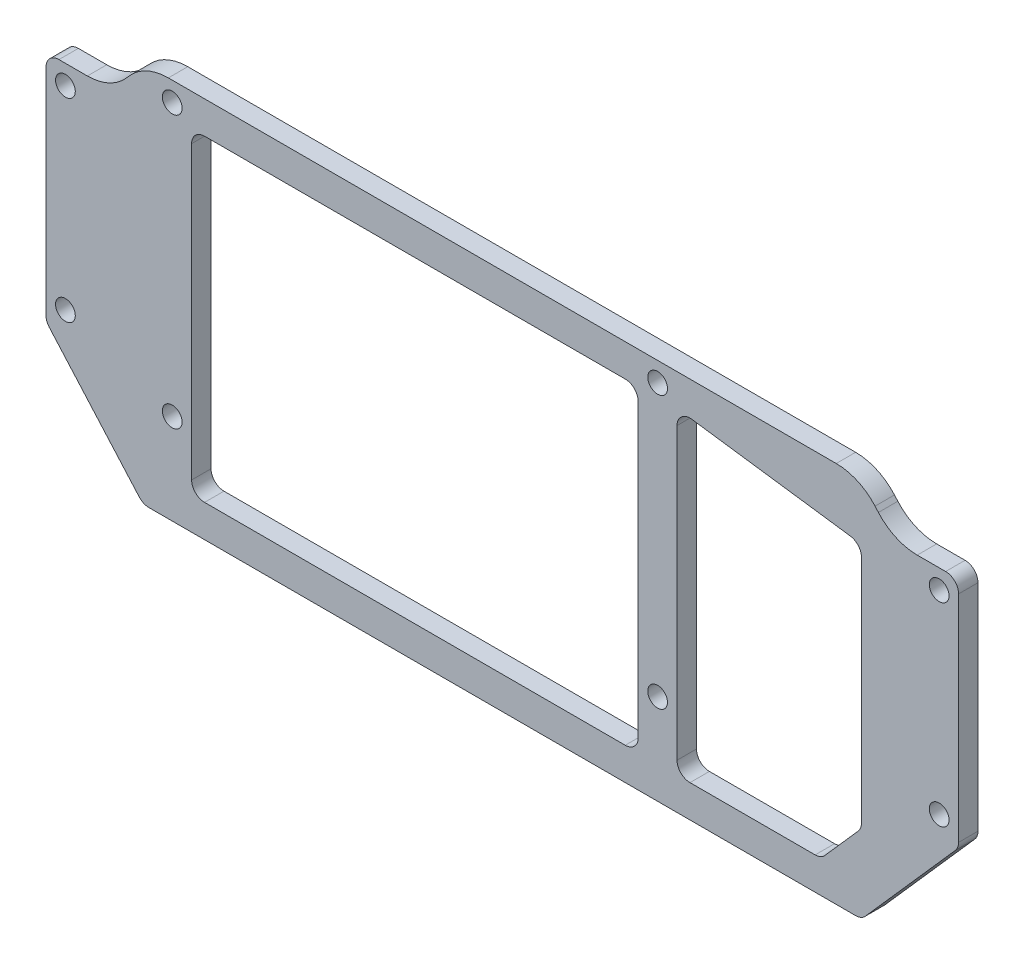
from build123d import *

# Parameters (mm, degrees)
SKETCH_1_R          = 1.525
EXTRUDE_1_DEPTH     = 1.5
SKETCH_2_R          = 1.525
CUT_EXTRUDE_1_DEPTH = 21
CUT_EXTRUDE_2_DEPTH = 11
CUT_EXTRUDE_3_DEPTH = 11
FILLET_1_R          = 8
SKETCH_5_W          = 69
SKETCH_5_H          = 49
CUT_EXTRUDE_4_DEPTH = 11
FILLET_2_R          = 2
FILLET_3_R          = 2


with BuildPart() as part:
    # 草图1 → 凸台-拉伸1 (new, symmetric)
    with BuildSketch(Plane.XY):
        Polygon((-70.5, -18), (-70.5, 18), (-55.5, 35), (55.5, 35), (70.5, 18), (70.5, -18), (55.5, -35), (-55.5, -35), align=None)
        with Locations((67.5, -15)):
            Circle(SKETCH_1_R, mode=Mode.SUBTRACT)
        with Locations((-67.5, -15)):
            Circle(SKETCH_1_R, mode=Mode.SUBTRACT)
        with Locations((-67.5, 15)):
            Circle(SKETCH_1_R, mode=Mode.SUBTRACT)
        with Locations((67.5, 15)):
            Circle(SKETCH_1_R, mode=Mode.SUBTRACT)
    extrude(amount=EXTRUDE_1_DEPTH, both=True)

    # 草图2 → 切除-拉伸1 (cut, symmetric)
    with BuildSketch(Plane(origin=(0, 0, -1.5), x_dir=(-1, 0, 0), z_dir=(0, 0, -1))):
        with Locations((-24, 21)):
            Circle(SKETCH_2_R)
        with Locations((-24, -21)):
            Circle(SKETCH_2_R)
        with Locations((51, 21)):
            Circle(SKETCH_2_R)
        with Locations((51, -21)):
            Circle(SKETCH_2_R)
    extrude(amount=CUT_EXTRUDE_1_DEPTH, both=True, mode=Mode.SUBTRACT)

    # 草图3 → 切除-拉伸2 (cut, symmetric)
    with BuildSketch(Plane(origin=(0, 0, -1.5), x_dir=(-1, 0, 0), z_dir=(0, 0, -1))):
        Polygon((-70.5, 18), (-60.5, 18), (-45.5, 35), (-55.5, 35), align=None)
        Polygon((55.5, 35), (70.5, 18), (60.5, 18), (45.5, 35), align=None)
    extrude(amount=CUT_EXTRUDE_2_DEPTH, both=True, mode=Mode.SUBTRACT)

    # 草图4 → 切除-拉伸3 (cut, symmetric)
    with BuildSketch(Plane(origin=(0, 0, -1.5), x_dir=(-1, 0, 0), z_dir=(0, 0, -1))):
        Polygon((-55.205882353, 24), (55.205882353, 24), (45.5, 35), (-45.5, 35), align=None)
    extrude(amount=CUT_EXTRUDE_3_DEPTH, both=True, mode=Mode.SUBTRACT)

    # 圆角1
    fillet_1_edges = [part.edges().sort_by_distance(p)[0] for p in [
        (55.205882353, 24, 0),
        (-55.205882353, 24, 0),
        (60.5, 18, 0),
        (-60.5, 18, 0),
    ]]
    fillet(fillet_1_edges, radius=FILLET_1_R)

    # 草图5 → 切除-拉伸4 (cut, symmetric)
    with BuildSketch(Plane(origin=(0, 0, -1.5), x_dir=(-1, 0, 0), z_dir=(0, 0, -1))):
        with Locations((13.5, -5.5)):
            Rectangle(SKETCH_5_W, SKETCH_5_H)
        Polygon((-55.5, 15.140970914), (-27, 19.072005396), (-27, -30), (-49.242791484, -30), (-55.5, -22.908497015), align=None)
    extrude(amount=CUT_EXTRUDE_4_DEPTH, both=True, mode=Mode.SUBTRACT)

    # 圆角2
    fillet_2_edges = [part.edges().sort_by_distance(p)[0] for p in [
        (-48, 19, 0),
        (-48, -30, 0),
        (21, -30, 0),
        (21, 19, 0),
        (55.5, -22.908497015, 0),
        (55.5, 15.140970914, 0),
        (27, 19.072005396, 0),
        (27, -30, 0),
        (49.242791484, -30, 0),
    ]]
    fillet(fillet_2_edges, radius=FILLET_2_R)

    # 圆角3
    fillet_3_edges = [part.edges().sort_by_distance(p)[0] for p in [
        (70.5, 18, 0),
        (70.5, -18, 0),
        (55.5, -35, 0),
        (-55.5, -35, 0),
        (-70.5, -18, 0),
        (-70.5, 18, 0),
    ]]
    fillet(fillet_3_edges, radius=FILLET_3_R)


solid = part.part
